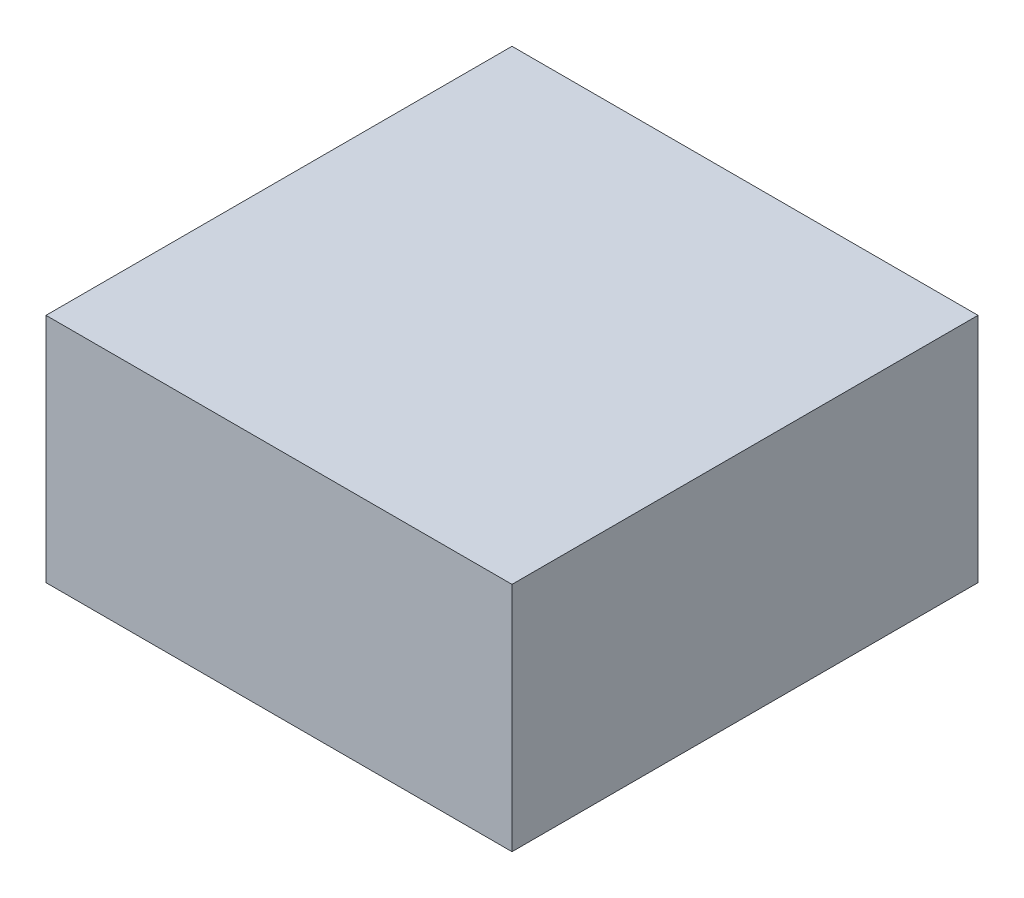
from build123d import *

# Parameters (mm, degrees)
SKETCH1_W           = 203.2
SKETCH1_H           = 203.2
BOSS_EXTRUDE1_DEPTH = 2.54
SKETCH2_W           = 203.2
SKETCH2_H           = 203.2
SKETCH2_W_2         = 196.85
SKETCH2_H_2         = 196.85
BOSS_EXTRUDE2_DEPTH = 98.425


with BuildPart() as part:
    # Sketch1 → Boss-Extrude1 (new body)
    with BuildSketch(Plane(origin=(0, 0, 0), x_dir=(1, 0, 0), z_dir=(0, 1, 0))):
        with Locations((101.6, -101.6)):
            Rectangle(SKETCH1_W, SKETCH1_H)
    extrude(amount=BOSS_EXTRUDE1_DEPTH)

    # Sketch2 → Boss-Extrude2 (add)
    with BuildSketch(Plane.XZ):
        with Locations((101.6, 101.6)):
            Rectangle(SKETCH2_W, SKETCH2_H)
        with Locations((101.6, 101.6)):
            Rectangle(SKETCH2_W_2, SKETCH2_H_2, mode=Mode.SUBTRACT)
    extrude(amount=BOSS_EXTRUDE2_DEPTH)


solid = part.part
